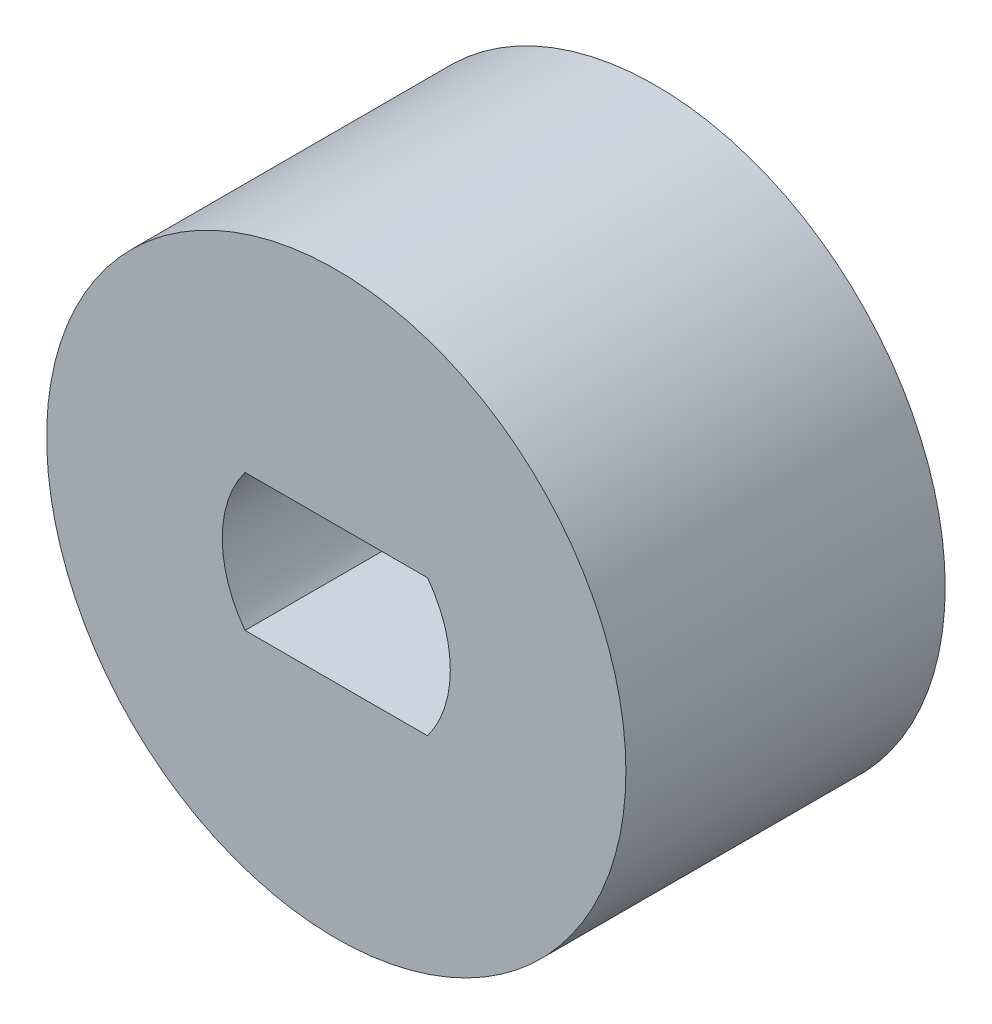
from build123d import *

# Parameters (mm, degrees)
SKETCH1_R           = 6.35
BOSS_EXTRUDE1_DEPTH = 7


with BuildPart() as part:
    # Sketch1 → Boss-Extrude1 (new body)
    with BuildSketch(Plane.XY):
        Circle(SKETCH1_R)
        with BuildLine():
            Line((2, 1.5), (-2, 1.5))
            ThreePointArc((-2, 1.5), (-2.5, 0), (-2, -1.5))
            Line((-2, -1.5), (2, -1.5))
            ThreePointArc((2, -1.5), (2.5, 0), (2, 1.5))
        make_face(mode=Mode.SUBTRACT)
    extrude(amount=BOSS_EXTRUDE1_DEPTH)


solid = part.part
